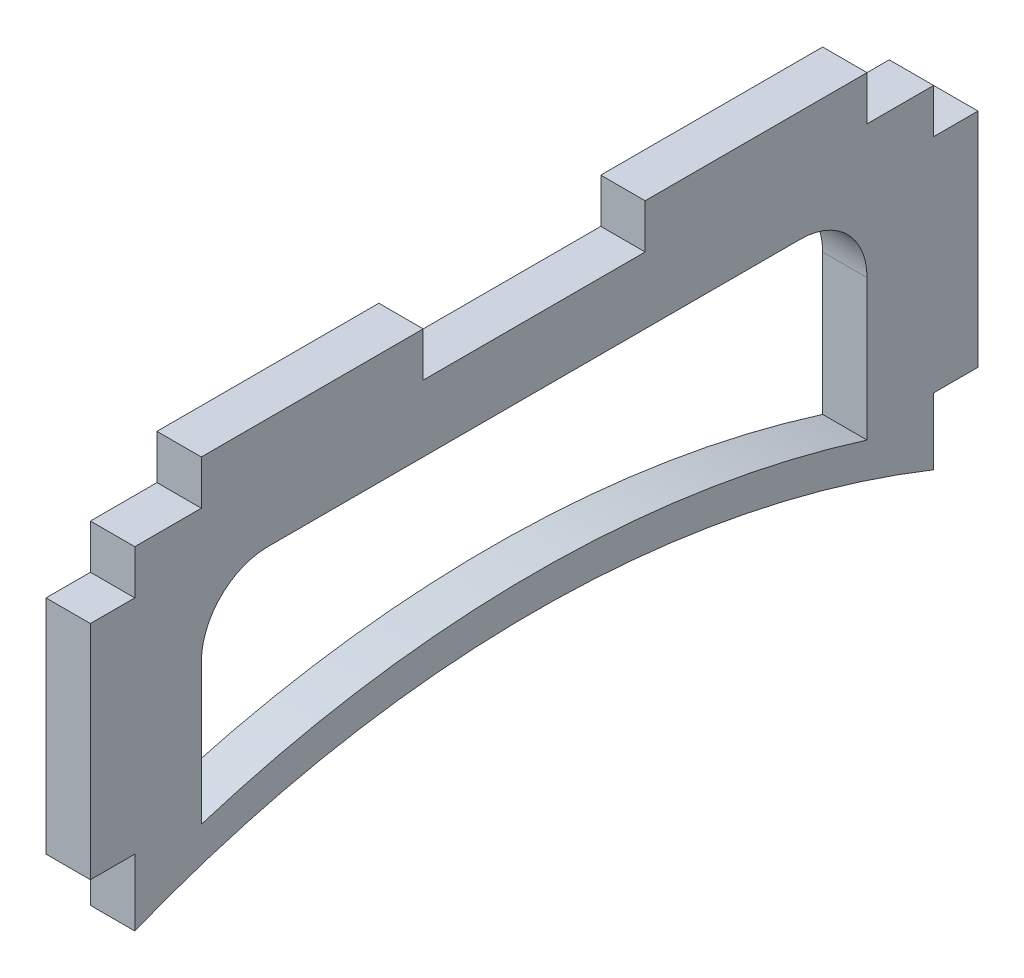
from build123d import *

# Parameters (mm, degrees)
BOSS_EXTRUDE1_DEPTH = 2


with BuildPart() as part:
    # Sketch1 → Boss-Extrude1 (new body)
    with BuildSketch(Plane(origin=(0, 0, 0), x_dir=(0, 0, -1), z_dir=(1, 0, 0))):
        with BuildLine():
            Line((-18, 0), (-15, 0))
            Line((-15, 0), (-15, 2))
            Line((-15, 2), (-5, 2))
            Line((-5, 2), (-5, 0))
            Line((-5, 0), (5, 0))
            Line((5, 0), (5, 2))
            Line((5, 2), (15, 2))
            Line((15, 2), (15, 0))
            Line((15, 0), (18, 0))
            Line((18, 0), (18, -2))
            Line((18, -2), (20, -2))
            Line((20, -2), (20, -12))
            Line((20, -12), (18, -12))
            Line((18, -12), (18, -15))
            ThreePointArc((18, -15), (0, -11.536096634), (-18, -15))
            Line((-18, -15), (-18, -12))
            Line((-18, -12), (-20, -12))
            Line((-20, -12), (-20, -2))
            Line((-20, -2), (-18, -2))
            Line((-18, -2), (-18, 0))
        make_face()
        with BuildLine():
            Line((-15, -12.339136563), (-15, -6))
            ThreePointArc((-15, -6), (-14.121320344, -3.878679656), (-12, -3))
            Line((-12, -3), (12, -3))
            ThreePointArc((12, -3), (14.121320344, -3.878679656), (15, -6))
            Line((15, -6), (15, -12.339136563))
            ThreePointArc((15, -12.339136563), (0, -10.036096634), (-15, -12.339136563))
        make_face(mode=Mode.SUBTRACT)
    extrude(amount=BOSS_EXTRUDE1_DEPTH)


solid = part.part
